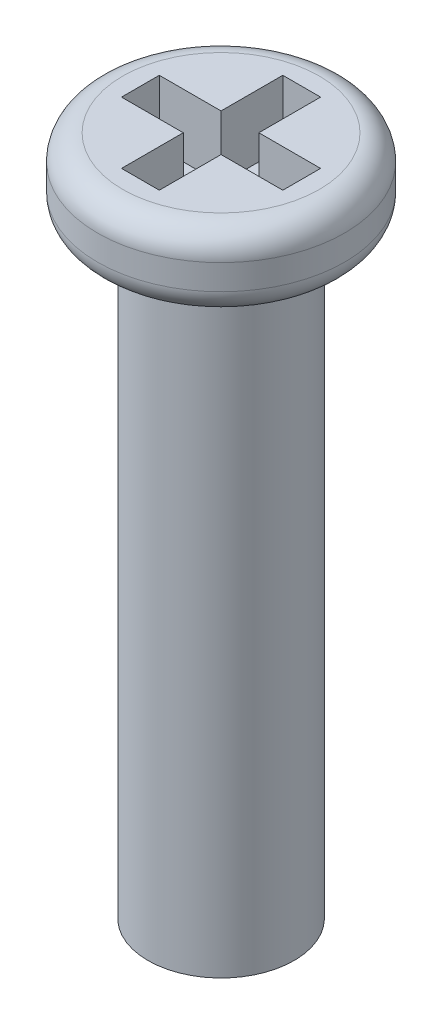
from build123d import *

# Parameters (mm, degrees)
SKETCH1_R           = 1.45
BOSS_EXTRUDE1_DEPTH = 12
SKETCH2_R           = 2.45
BOSS_EXTRUDE2_DEPTH = 1.5
FILLET1_R           = 0.5
SKETCH3_W           = 0.75
SKETCH3_H           = 1.225
SKETCH3_H_2         = 0.75
SKETCH3_W_2         = 1.225
CUT_EXTRUDE1_DEPTH  = 1.25
FILLET4_R           = 0.5


with BuildPart() as part:
    # Sketch1 → Boss-Extrude1 (new body)
    with BuildSketch(Plane(origin=(0, 0, 0), x_dir=(1, 0, 0), z_dir=(0, 1, 0))):
        with Locations(Location((0, 0, 0), (0, 0, 270))):
            Circle(SKETCH1_R)
    extrude(amount=BOSS_EXTRUDE1_DEPTH)

    # Sketch2 → Boss-Extrude2 (add)
    with BuildSketch(Plane(origin=(0, 12, 0), x_dir=(1, 0, 0), z_dir=(0, 1, 0))):
        with Locations(Location((0, 0, 0), (0, 0, 270))):
            Circle(SKETCH2_R)
    extrude(amount=BOSS_EXTRUDE2_DEPTH)

    # Fillet1
    fillet1_edges = [part.edges().sort_by_distance(p)[0] for p in [
        (0, 12, -2.45),
        (0, 13.5, -2.45),
    ]]
    fillet(fillet1_edges, radius=FILLET1_R)

    # Sketch3 → Cut-Extrude1 (cut)
    with BuildSketch(Plane(origin=(0, 13.5, 0), x_dir=(1, 0, 0), z_dir=(0, 1, 0))):
        with Locations((0, 0.9875)):
            Rectangle(SKETCH3_W, SKETCH3_H)
        Rectangle(SKETCH3_W, SKETCH3_H_2)
        with Locations((0, -0.9875)):
            Rectangle(SKETCH3_W, SKETCH3_H)
        with Locations((0.9875, 0)):
            Rectangle(SKETCH3_W_2, SKETCH3_H_2)
        with Locations((-0.9875, 0)):
            Rectangle(SKETCH3_W_2, SKETCH3_H_2)
    extrude(amount=-CUT_EXTRUDE1_DEPTH, mode=Mode.SUBTRACT)

    # Fillet4
    fillet4_edges = [part.edges().sort_by_distance(p)[0] for p in [
        (0, 12.25, 1.6),
        (-1.6, 12.25, 0),
        (0, 12.25, -1.6),
        (1.6, 12.25, 0),
    ]]
    fillet(fillet4_edges, radius=FILLET4_R)


solid = part.part
